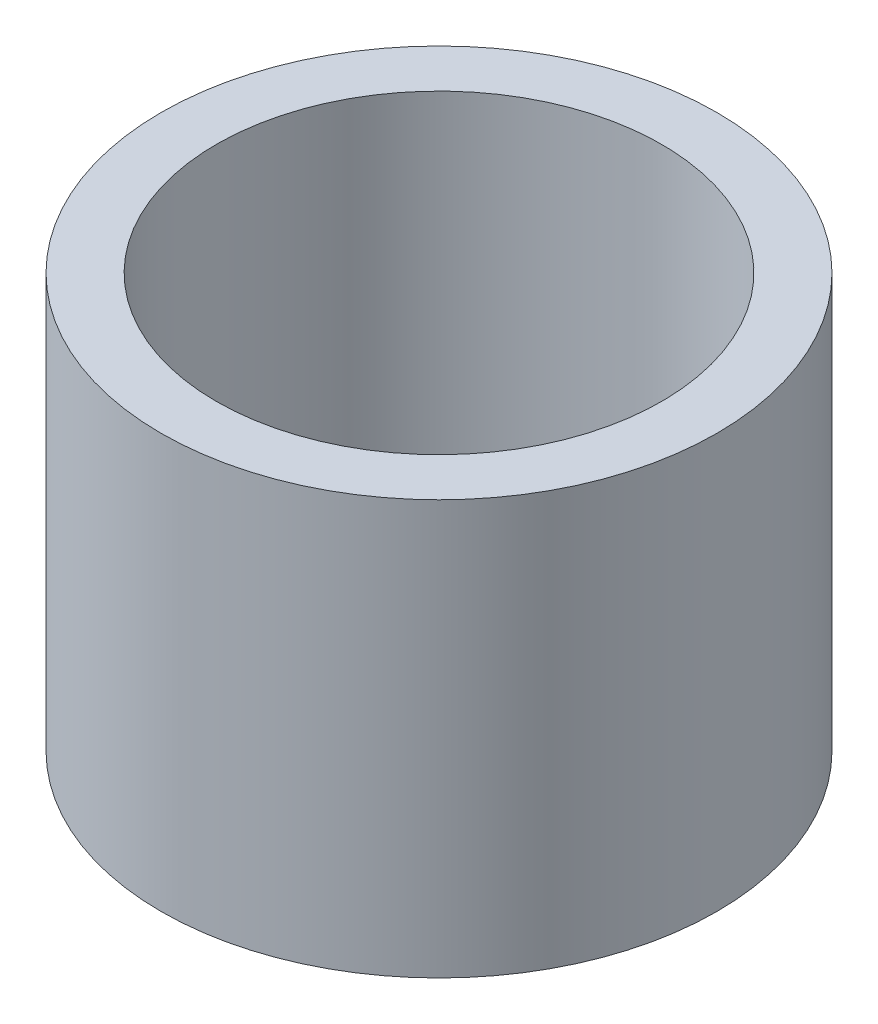
from build123d import *

# Parameters (mm, degrees)
SKETCH1_R      = 51.1302
SKETCH1_R_2    = 40.9702
ABLATIVE_DEPTH = 76.2


with BuildPart() as part:
    # Sketch1 → Ablative (new body)
    with BuildSketch(Plane(origin=(0, 0, 0), x_dir=(1, 0, 0), z_dir=(0, 1, 0))):
        Circle(SKETCH1_R)
        Circle(SKETCH1_R_2, mode=Mode.SUBTRACT)
    extrude(amount=-ABLATIVE_DEPTH)


solid = part.part
